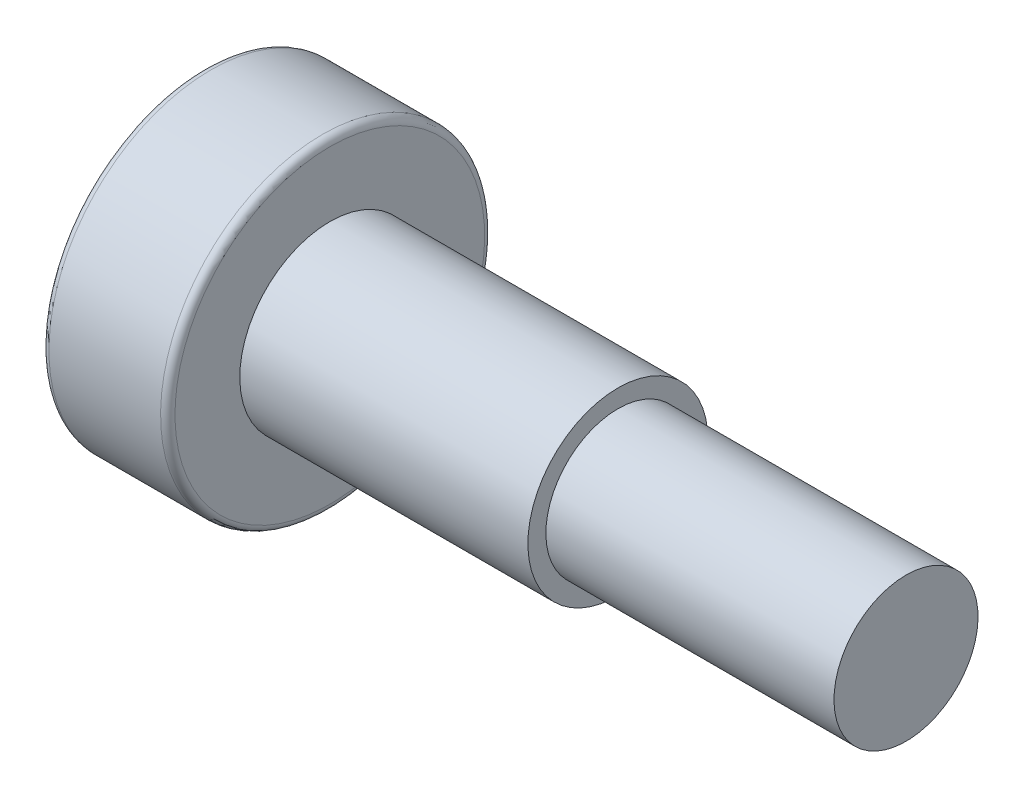
from build123d import *

# Parameters (mm, degrees)
CUT_EXTRUDE_1_DEPTH = 2
FILLET_1_R          = 0.2


with BuildPart() as part:
    # 草图1 → 旋转1 (revolve)
    with BuildSketch(Plane.XY):
        Polygon((0, 0), (0, 4.5), (3.5, 4.5), (3.5, 2.5), (11.5, 2.5), (11.5, 2), (19.5, 2), (19.5, 0), align=None)
    revolve(axis=Axis((19.5, 0, 0), (-1, 0, 0)))

    # 草图2 → 切除-拉伸1 (cut)
    with BuildSketch(Plane.ZY):
        Polygon((1.5, 0.866025404), (0, 1.732050808), (-1.5, 0.866025404), (-1.5, -0.866025404), (0, -1.732050808), (1.5, -0.866025404), align=None)
    extrude(amount=-CUT_EXTRUDE_1_DEPTH, mode=Mode.SUBTRACT)

    # 圆角1
    fillet_1_edges = [part.edges().sort_by_distance(p)[0] for p in [
        (3.5, -4.5, 0),
        (0, -4.5, 0),
    ]]
    fillet(fillet_1_edges, radius=FILLET_1_R)


solid = part.part
